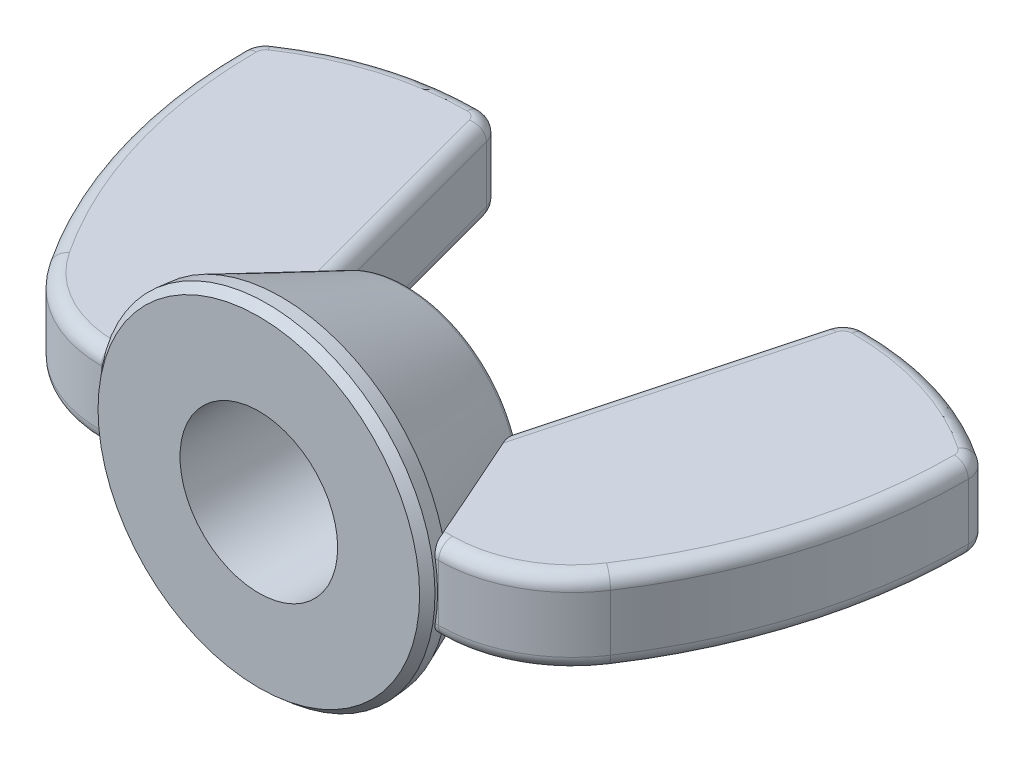
from build123d import *

# Parameters (mm, degrees)
EXTRUDE2_DEPTH     = 1.28984375
SKETCH3_R          = 5.159375
EXTRUDE1_DEPTH     = 0.6858
EXTRUDE1_DRAFT     = -5
SKETCH15_R         = 5.099375275
EXTRUDE3_DEPTH     = 3.8862
EXTRUDE3_TAPER     = 22.89012698
FILLET3_R          = 0.254
SKETCH4_R          = 2.413
CUT_EXTRUDE1_DEPTH = 18.646438922
CHAMFER1_SIZE      = 0.257175
CHAMFER1_SIZE2     = 0.237388559
FILLET4_R          = 0.429947917


with BuildPart() as part:
    # Sketch13 → Extrude2 (new, symmetric)
    with BuildSketch(Plane(origin=(0, 0, 0), x_dir=(1, 0, 0), z_dir=(0, 1, 0))):
        with BuildLine():
            Line((3.166712045, 0.3429), (5.159375, 0.3429))
            ThreePointArc((5.159375, 0.3429), (7.101768744, 0.832103373), (8.580723973, 2.182993757))
            ThreePointArc((8.580723973, 2.182993757), (10.465874951, 6.208977734), (11.1125, 10.607183874))
            ThreePointArc((11.1125, 10.607183874), (11.028622602, 10.943597741), (10.796626512, 11.201255503))
            ThreePointArc((10.796626512, 11.201255503), (8.457534763, 12.316945036), (5.894454148, 12.7))
            ThreePointArc((5.894454148, 12.7), (5.458227968, 12.551921165), (5.202291154, 12.168884654))
            Line((5.202291154, 12.168884654), (3.166712045, 4.572))
            Line((3.166712045, 4.572), (3.166712045, 0.3429))
        make_face()
    extrude(amount=EXTRUDE2_DEPTH, both=True)

    # Fillet4
    fillet4_edges = [part.edges().sort_by_distance(p)[0] for p in [
        (7.101768744, 1.28984375, -0.832103373),
        (4.163043523, -1.28984375, -0.3429),
        (10.465874951, 1.28984375, -6.208977734),
        (11.028622602, 1.28984375, -10.943597741),
        (8.457534763, 1.28984375, -12.316945036),
        (5.458227968, 1.28984375, -12.551921165),
        (4.1845016, 1.28984375, -8.370442327),
        (4.163043523, 1.28984375, -0.3429),
        (4.1845016, -1.28984375, -8.370442327),
        (5.458227968, -1.28984375, -12.551921165),
        (8.457534763, -1.28984375, -12.316945036),
        (11.028622602, -1.28984375, -10.943597741),
        (10.465874951, -1.28984375, -6.208977734),
        (7.101768744, -1.28984375, -0.832103373),
    ]]
    fillet(fillet4_edges, radius=FILLET4_R)


with BuildPart() as body_2:
    # Sketch3 → Extrude1 (with draft: the straight prism first)
    with BuildSketch(Plane.XY):
        Circle(SKETCH3_R)
    extrude(amount=-EXTRUDE1_DEPTH)
    # Extrude1: the draft: its side faces are tilted about the plane it starts from
    extrude1_sides = [body_2.faces().sort_by_distance(p)[0] for p in [
        (-5.159375, 0, -0.3429),
    ]]
    draft(extrude1_sides, Plane.XY, EXTRUDE1_DRAFT)

    # Sketch15 → Extrude3 (add)
    with BuildSketch(Plane(origin=(0, 0, -0.6858), x_dir=(-1, 0, 0), z_dir=(0, 0, -1))):
        Circle(SKETCH15_R)
    extrude(amount=EXTRUDE3_DEPTH, taper=EXTRUDE3_TAPER)

    # Fillet3
    fillet3_edges = [body_2.edges().sort_by_distance(p)[0] for p in [
        (3.458569214, 0, -4.572),
    ]]
    fillet(fillet3_edges, radius=FILLET3_R)

    # Sketch4 → Cut-Extrude1 (cut, through all)
    with BuildSketch(Plane.XY):
        Circle(SKETCH4_R)
    extrude(amount=-CUT_EXTRUDE1_DEPTH, mode=Mode.SUBTRACT)

    # Chamfer1
    chamfer1_edges = [body_2.edges().sort_by_distance(p)[0] for p in [
        (-5.159375, 0, 0),
    ]]
    chamfer1_side = [body_2.faces().sort_by_distance(p)[0] for p in [
        (-5.129375137, 0, -0.3429),
    ]]
    chamfer(chamfer1_edges, length=CHAMFER1_SIZE, length2=CHAMFER1_SIZE2, reference=chamfer1_side[0])


with BuildPart() as body_3:
    # Mirror6: mirrored copy
    add(part.part.mirror(Plane(origin=(0, 0, 0), x_dir=(0, 0, 1), z_dir=(1, 0, 0))))

    # Combine2: union part, body 2
    add(part.part)
    add(body_2.part)


solid = body_3.part
